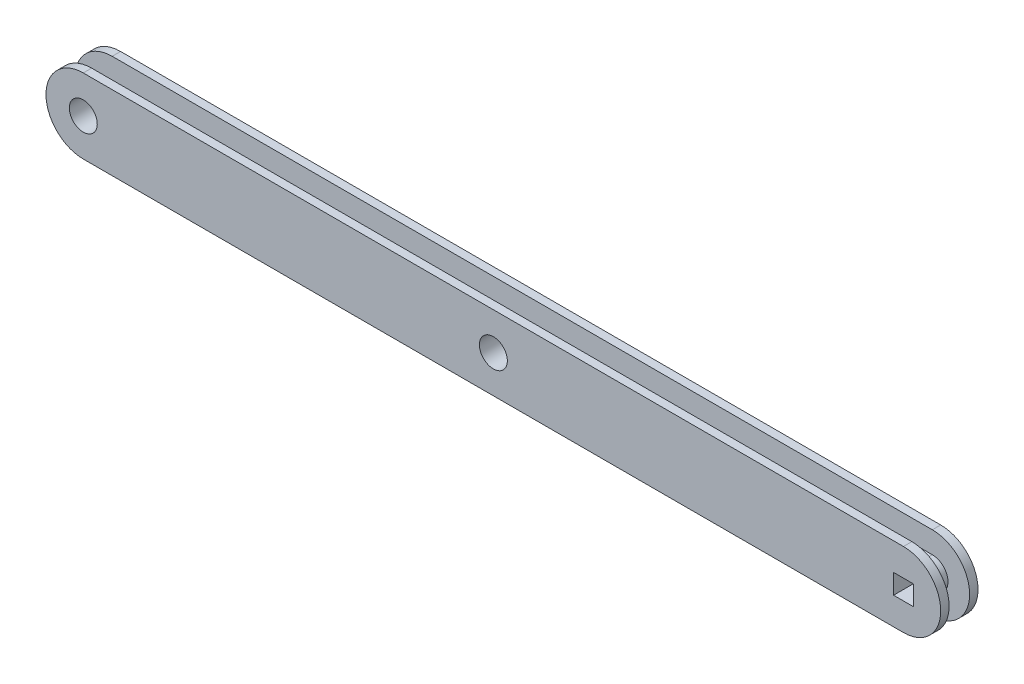
from build123d import *

# Parameters (mm, degrees)
ESQUISSE1_W             = 152.4
ESQUISSE1_H             = 12.7
BOSS_EXTRU_1_DEPTH      = 6.35
ESQUISSE2_W             = 3.367596046
ESQUISSE2_H             = 3.367596046
ESQUISSE2_R             = 2.38125
ENL_V_MAT_EXTRU_1_DEPTH = 154.060029074
SKETCH1_W               = 17.85376538
SKETCH1_H               = 3.495000122
CUT_REVOLVE1_ANGLE      = 180
SKETCH2_W               = 3.495000122
SKETCH2_H               = 3.683
CUT_EXTRUDE1_DEPTH      = 154.060029074


with BuildPart() as part:
    # Esquisse1 → Boss.-Extru.1 (new body)
    with BuildSketch(Plane.XY):
        with Locations((-76.2, 6.35)):
            Rectangle(ESQUISSE1_W, ESQUISSE1_H)
    extrude(amount=-BOSS_EXTRU_1_DEPTH)

    # Esquisse2 → Enlèv. mat.-Extru.1 (cut, through all)
    with BuildSketch(Plane.XY):
        with BuildLine():
            Line((0, 12.7), (-6.35, 12.7))
            ThreePointArc((-6.35, 12.7), (-1.859871939, 10.840128061), (0, 6.35))
            Line((0, 6.35), (0, 12.7))
        make_face()
        with BuildLine():
            Line((0, 0), (0, 6.35))
            ThreePointArc((0, 6.35), (-1.859871939, 1.859871939), (-6.35, 0))
            Line((-6.35, 0), (0, 0))
        make_face()
        with BuildLine():
            ThreePointArc((-152.4, 6.35), (-150.540128061, 10.840128061), (-146.05, 12.7))
            Line((-146.05, 12.7), (-152.4, 12.7))
            Line((-152.4, 12.7), (-152.4, 6.35))
        make_face()
        with BuildLine():
            ThreePointArc((-146.05, 0), (-150.540128061, 1.859871939), (-152.4, 6.35))
            Line((-152.4, 6.35), (-152.4, 0))
            Line((-152.4, 0), (-146.05, 0))
        make_face()
        with Locations((-6.35, 6.35)):
            Rectangle(ESQUISSE2_W, ESQUISSE2_H)
        with Locations((-146.05, 6.35)):
            Circle(ESQUISSE2_R)
        with Locations((-76.2, 6.35)):
            Circle(ESQUISSE2_R)
    extrude(amount=-ENL_V_MAT_EXTRU_1_DEPTH, mode=Mode.SUBTRACT)

    # Sketch1 → Cut-Revolve1 (revolve, symmetric, cut)
    with BuildSketch(Plane(origin=(0, 6.35, 0), x_dir=(1, 0, 0), z_dir=(0, 1, 0))) as cut_revolve1_sk:
        with Locations((-157.64388269, 3.175)):
            Rectangle(SKETCH1_W, SKETCH1_H)
    cut_revolve1 = revolve(axis=Axis((-146.05, 6.35, -6.35), (0, 0, 1)), revolution_arc=CUT_REVOLVE1_ANGLE / 2, mode=Mode.SUBTRACT)
    cut_revolve1 = cut_revolve1 + revolve(cut_revolve1_sk.sketch, axis=Axis((-146.05, 6.35, -6.35), (0, 0, -1)), revolution_arc=CUT_REVOLVE1_ANGLE / 2, mode=Mode.SUBTRACT)

    # Mirror1: Cut-Revolve1 across plane
    add(cut_revolve1.mirror(Plane(origin=(-76.2, 0, 0), x_dir=(0, 0, 1), z_dir=(1, 0, 0))), mode=Mode.SUBTRACT)

    # Sketch2 → Cut-Extrude1 (cut, through all)
    with BuildSketch(Plane(origin=(0, 0, 0), x_dir=(0, 0, -1), z_dir=(1, 0, 0))):
        with Locations((3.175, 10.8585)):
            Rectangle(SKETCH2_W, SKETCH2_H)
    cut_extrude1 = extrude(amount=-CUT_EXTRUDE1_DEPTH, mode=Mode.SUBTRACT)

    # Mirror2: Cut-Extrude1 across plane
    add(cut_extrude1.mirror(Plane.ZX.offset(6.35)), mode=Mode.SUBTRACT)


solid = part.part
